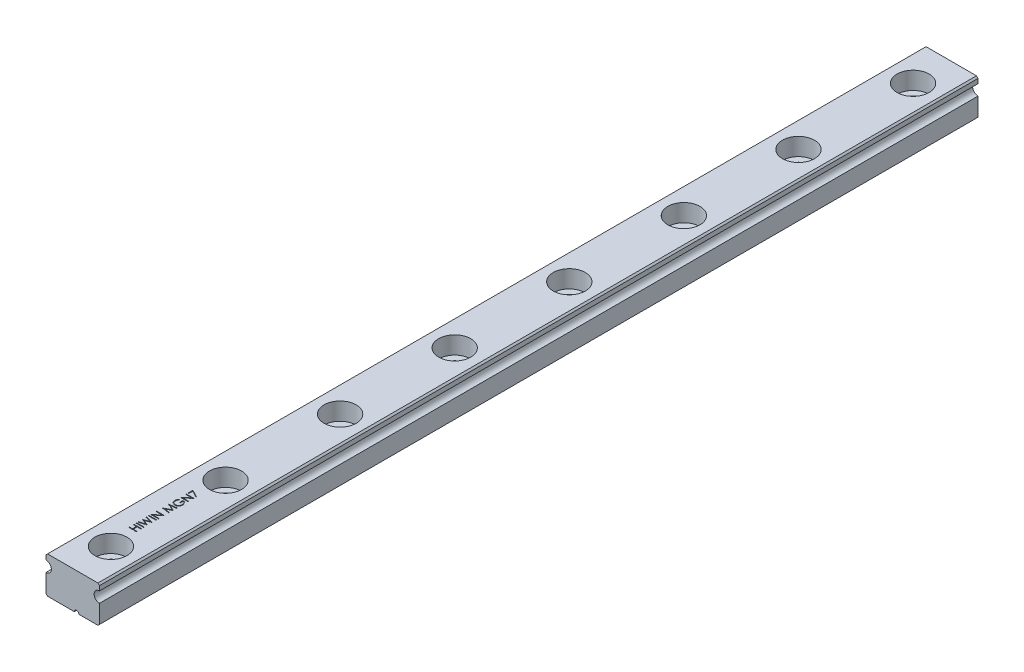
from build123d import *

# Parameters (mm, degrees)
EXTRUDE_1_DEPTH              = 115
HOLE_WIZARD_M2_1_D           = 2.4
HOLE_WIZARD_M2_1_CBORE_D     = 4.2
HOLE_WIZARD_M2_1_CBORE_DEPTH = 2.3
PATTERN_LINEAR_1_COUNT       = 8
PATTERN_LINEAR_1_PITCH       = 15
SKETCH_6_W                   = 1
SKETCH_6_H                   = 0.089743589
CUT_EXTRUDE_1_DEPTH          = 0.1


with BuildPart() as part:
    # 草图1 → 凸台-拉伸1 (new body)
    with BuildSketch(Plane.XY):
        with BuildLine():
            Line((-3.5, 4.6), (-3.5, 4))
            ThreePointArc((-3.5, 4), (-2.8, 3.3), (-3.5, 2.6))
            Line((-3.5, 2.6), (-3.5, 0.2))
            Line((-3.5, 0.2), (-3.3, 0))
            Line((-3.3, 0), (0.2, 0))
            ThreePointArc((0.2, 0), (0.5, 0.3), (0.8, 0))
            Line((0.8, 0), (3.3, 0))
            Line((3.3, 0), (3.5, 0.2))
            Line((3.5, 0.2), (3.5, 2.6))
            ThreePointArc((3.5, 2.6), (2.8, 3.3), (3.5, 4))
            Line((3.5, 4), (3.5, 4.6))
            Line((3.5, 4.6), (3.3, 4.8))
            Line((3.3, 4.8), (-3.3, 4.8))
            Line((-3.3, 4.8), (-3.5, 4.6))
        make_face()
    extrude(amount=-EXTRUDE_1_DEPTH)

    # M2 六角凹头螺钉的柱形沉头孔1 (through all)
    with Locations(Plane(origin=(1.647961524, 4.8, 19.977127426), x_dir=(-1, 0, 0), z_dir=(0, 1, 0))):
        with Locations((1.647961524, -24.977127426)):
            hole_wizard_m2_1 = CounterBoreHole(HOLE_WIZARD_M2_1_D / 2, HOLE_WIZARD_M2_1_CBORE_D / 2, HOLE_WIZARD_M2_1_CBORE_DEPTH)

    # 阵列(线性)1: M2 六角凹头螺钉的柱形沉头孔1 ×8
    with Locations(*[(0, 0, -i * PATTERN_LINEAR_1_PITCH) for i in range(1, PATTERN_LINEAR_1_COUNT)]):
        add(hole_wizard_m2_1, mode=Mode.SUBTRACT)

    # 草图6 → 切除-拉伸1 (cut)
    with BuildSketch(Plane(origin=(0, 4.8, 0), x_dir=(1, 0, 0), z_dir=(0, 1, 0))):
        Polygon((-1, 8.326923077), (-1, 8.416666667), (-0.58974359, 8.416666667), (-0.58974359, 8.929487179), (-1, 8.929487179), (-1, 9.019230769), (0, 9.019230769), (0, 8.929487179), (-0.487179487, 8.929487179), (-0.487179487, 8.416666667), (0, 8.416666667), (0, 8.326923077), align=None)
        with Locations((-0.5, 9.32051282)):
            Rectangle(SKETCH_6_W, SKETCH_6_H)
        Polygon((-1, 9.519230769), (-1, 9.611979167), (-0.266626603, 9.807692308), (-1, 10.098758013), (-1, 10.111778846), (-0.271634615, 10.397435897), (-1, 10.594150641), (-1, 10.685897436), (0, 10.416266026), (0, 10.403445513), (-0.764823718, 10.102564103), (0, 9.798076923), (0, 9.78525641), align=None)
        with Locations((-0.5, 10.961538462)):
            Rectangle(SKETCH_6_W, SKETCH_6_H)
        Polygon((0, 11.224358974), (-1, 11.224358974), (-1, 11.243189103), (-0.212940705, 11.903846154), (-1, 11.903846154), (-1, 11.993589744), (0, 11.993589744), (0, 11.973157051), (-0.78525641, 11.314102564), (0, 11.314102564), align=None)
        Polygon((0, 12.583333333), (-1, 12.715344551), (-1, 12.728165064), (-0.179487179, 13.141025641), (-1, 13.552884615), (-1, 13.565905449), (0, 13.698717949), (0, 13.608573718), (-0.719551282, 13.512820513), (0, 13.151842949), (0, 13.131610577), (-0.721153846, 12.769230769), (0, 12.673677885), align=None)
        with BuildLine():
            Line((-0.829326923, 14.83974359), (-0.756410256, 14.762820513))
            add(Edge.make_bspline(
                [(-0.756410256, 14.762820513), (-0.769509177, 14.748903633), (-0.795394667, 14.721401728), (-0.828926878, 14.676487459), (-0.857936286, 14.629814358), (-0.881363598, 14.581306958), (-0.899741215, 14.532237244), (-0.913100062, 14.483448972), (-0.921560108, 14.435258029), (-0.922576227, 14.403211086), (-0.923076923, 14.387419872)],
                knots=[0, 0, 0, 0, 1.089067066, 2.152164705, 3.18986567, 4.218445106, 5.218487318, 6.173592265, 7.100032889, 8, 8, 8, 8], degree=3))
            add(Edge.make_bspline(
                [(-0.923076923, 14.387419872), (-0.92295875, 14.377729958), (-0.92272271, 14.35837526), (-0.919710077, 14.329626133), (-0.915377259, 14.301178523), (-0.909108151, 14.27308613), (-0.901162706, 14.245294334), (-0.891224001, 14.217899794), (-0.879636792, 14.190851402), (-0.8662475, 14.164403968), (-0.851539021, 14.138763759), (-0.835239261, 14.11454776), (-0.817871683, 14.091600199), (-0.798997604, 14.070357569), (-0.778802089, 14.050678565), (-0.757648841, 14.032201222), (-0.735121964, 14.015269914), (-0.711314092, 14.000188302), (-0.686779105, 13.98656899), (-0.661725084, 13.97479979), (-0.636384612, 13.964568374), (-0.61056688, 13.956775814), (-0.584538056, 13.950175564), (-0.558161739, 13.945580925), (-0.531369048, 13.942981978), (-0.513426849, 13.942533266), (-0.504407051, 13.942307692)],
                knots=[0, 0, 0, 0, 1.028150113, 2.053633673, 3.06513288, 4.081487945, 5.106702018, 6.131327874, 7.172780699, 8.228344599, 9.276313556, 10.308389736, 11.324843658, 12.329040066, 13.321460474, 14.316307835, 15.308626991, 16.309440696, 17.305625405, 18.28535951, 19.246194545, 20.203493668, 21.145557131, 22.095268976, 23.042464743, 24, 24, 24, 24], degree=3))
            add(Edge.make_bspline(
                [(-0.504407051, 13.942307692), (-0.495186862, 13.942523748), (-0.476771662, 13.94295527), (-0.449286976, 13.945713326), (-0.422213666, 13.950843386), (-0.395509151, 13.957646743), (-0.369120284, 13.966296079), (-0.343074603, 13.976922511), (-0.31737464, 13.989581406), (-0.292275521, 14.004201769), (-0.267846912, 14.020347331), (-0.244643347, 14.038104812), (-0.222934856, 14.057504108), (-0.202404358, 14.078189521), (-0.183181421, 14.10034952), (-0.165497749, 14.1241991), (-0.149079898, 14.149404412), (-0.134108231, 14.175976638), (-0.120734697, 14.203634918), (-0.108842066, 14.231993898), (-0.099047993, 14.261144727), (-0.091065671, 14.29093406), (-0.084522731, 14.321326426), (-0.08031345, 14.352476083), (-0.077258927, 14.384154), (-0.077035593, 14.405507895), (-0.076923077, 14.416266026)],
                knots=[0, 0, 0, 0, 0.935915162, 1.869274651, 2.799799983, 3.730201895, 4.664668062, 5.616159355, 6.583070886, 7.570012957, 8.562524459, 9.553461134, 10.53281078, 11.515274572, 12.509912756, 13.507571325, 14.526460018, 15.561318395, 16.601025881, 17.643204557, 18.680545676, 19.719612342, 20.772381578, 21.833430283, 22.908478249, 24, 24, 24, 24], degree=3))
            add(Edge.make_bspline(
                [(-0.076923077, 14.416266026), (-0.077193986, 14.429231321), (-0.077725961, 14.454690783), (-0.081870496, 14.492114732), (-0.088335201, 14.528061194), (-0.097832073, 14.562413148), (-0.109852773, 14.595295261), (-0.124718081, 14.626586257), (-0.142271591, 14.656372541), (-0.162157847, 14.684525187), (-0.184314551, 14.710374908), (-0.208010182, 14.733901216), (-0.233551734, 14.754295108), (-0.260558548, 14.77216577), (-0.28928895, 14.786936411), (-0.319583111, 14.799063805), (-0.351459775, 14.808358792), (-0.373485924, 14.812174532), (-0.384615385, 14.814102564)],
                knots=[0, 0, 0, 0, 1.130199668, 2.219330667, 3.279027493, 4.311506524, 5.322739849, 6.327972234, 7.327472899, 8.33386792, 9.329086447, 10.29244429, 11.240784345, 12.174119183, 13.111530729, 14.052100829, 15.015757696, 16, 16, 16, 16], degree=3))
            Line((-0.384615385, 14.814102564), (-0.384615385, 14.480769231))
            Line((-0.384615385, 14.480769231), (-0.487179487, 14.480769231))
            Line((-0.487179487, 14.480769231), (-0.487179487, 14.903846154))
            add(Edge.make_bspline(
                [(-0.487179487, 14.903846154), (-0.468063062, 14.903358769), (-0.430648764, 14.902404868), (-0.37608583, 14.895713749), (-0.32455106, 14.884909031), (-0.275990182, 14.870148942), (-0.230472013, 14.851041719), (-0.187950337, 14.827792425), (-0.148699857, 14.800028962), (-0.112400142, 14.768740264), (-0.080020367, 14.733625991), (-0.051561527, 14.695634957), (-0.027589351, 14.654704394), (-0.008086305, 14.610873021), (0.007134836, 14.564284325), (0.017926715, 14.514830502), (0.024392419, 14.462578617), (0.025218528, 14.426768137), (0.025641026, 14.408453526)],
                knots=[0, 0, 0, 0, 1.140356446, 2.231883559, 3.274166699, 4.278491846, 5.25512956, 6.21435461, 7.1637429, 8.11826594, 9.068280886, 10.0076534, 10.945064095, 11.891975133, 12.864533718, 13.863980011, 14.907571808, 16, 16, 16, 16], degree=3))
            add(Edge.make_bspline(
                [(0.025641026, 14.408453526), (0.02547842, 14.397164916), (0.025157708, 14.374900138), (0.022878466, 14.342017016), (0.01936973, 14.310040553), (0.014071123, 14.278975407), (0.007581222, 14.24870731), (-0.000729269, 14.219387428), (-0.010348898, 14.190904073), (-0.021290519, 14.16321322), (-0.033968135, 14.136566207), (-0.048056603, 14.110844345), (-0.063483278, 14.085905452), (-0.080514948, 14.061919405), (-0.099024222, 14.038761227), (-0.119048199, 14.016580243), (-0.140525662, 13.995252278), (-0.155776807, 13.981892146), (-0.163461538, 13.975160256)],
                knots=[0, 0, 0, 0, 1.107784379, 2.184907829, 3.233506516, 4.263428166, 5.276301166, 6.270063455, 7.25232949, 8.225834625, 9.190232166, 10.146266622, 11.1027726, 12.066435141, 13.031522626, 14.010570082, 14.99756817, 16, 16, 16, 16], degree=3))
            add(Edge.make_bspline(
                [(-0.163461538, 13.975160256), (-0.175653154, 13.965392847), (-0.199834016, 13.946020158), (-0.238576857, 13.921083542), (-0.278691674, 13.899825998), (-0.320290139, 13.882578049), (-0.363333343, 13.869110024), (-0.407766283, 13.859451095), (-0.453646178, 13.853791869), (-0.484693396, 13.852976573), (-0.500400641, 13.852564103)],
                knots=[0, 0, 0, 0, 1.023165419, 2.029347347, 3.013907458, 3.994755782, 4.975994455, 5.96558838, 6.970761222, 8, 8, 8, 8], degree=3))
            add(Edge.make_bspline(
                [(-0.500400641, 13.852564103), (-0.512162428, 13.852716171), (-0.535536515, 13.853018374), (-0.570238603, 13.856682808), (-0.604324516, 13.861940354), (-0.637766384, 13.86966809), (-0.670586575, 13.879409857), (-0.702800197, 13.89156808), (-0.734426755, 13.905723445), (-0.765246694, 13.92217765), (-0.794858013, 13.940483004), (-0.823115804, 13.960370906), (-0.849562095, 13.981994816), (-0.874258149, 14.0054177), (-0.897569993, 14.030167394), (-0.919010679, 14.05676348), (-0.938915717, 14.084803005), (-0.956902635, 14.11450333), (-0.973064879, 14.145395796), (-0.987232901, 14.177413249), (-0.998942507, 14.210544055), (-1.008877849, 14.244540499), (-1.016225039, 14.279659779), (-1.02155325, 14.315647077), (-1.025199136, 14.352689966), (-1.025492352, 14.377728831), (-1.025641026, 14.390424679)],
                knots=[0, 0, 0, 0, 1.00895651, 2.005089799, 2.991467152, 3.967318338, 4.948153826, 5.927364234, 6.919980553, 7.91976625, 8.923240147, 9.905815003, 10.88314567, 11.851989312, 12.825009789, 13.798721852, 14.781296708, 15.773896486, 16.776076962, 17.771600213, 18.775744723, 19.78957137, 20.808953803, 21.851964491, 22.910847925, 24, 24, 24, 24], degree=3))
            add(Edge.make_bspline(
                [(-1.025641026, 14.390424679), (-1.025475457, 14.400778463), (-1.025147153, 14.4213088), (-1.022871539, 14.451859009), (-1.019264716, 14.481937014), (-1.014342777, 14.511587411), (-1.007638865, 14.54070923), (-0.999616498, 14.569385431), (-0.990275977, 14.597657584), (-0.979136307, 14.625437084), (-0.966492414, 14.652910717), (-0.952260008, 14.680231243), (-0.936195721, 14.707305313), (-0.918251853, 14.73417988), (-0.898736591, 14.76102441), (-0.877091784, 14.787414308), (-0.854170997, 14.813986578), (-0.837690373, 14.831072811), (-0.829326923, 14.83974359)],
                knots=[0, 0, 0, 0, 0.985871117, 1.954866573, 2.915460327, 3.869826059, 4.81536089, 5.759505086, 6.70452669, 7.649098992, 8.607881297, 9.583363685, 10.581137262, 11.603961102, 12.659522466, 13.73993555, 14.853081303, 16, 16, 16, 16], degree=3))
        make_face()
        Polygon((0, 15.108974359), (-1, 15.108974359), (-1, 15.127804487), (-0.212940705, 15.788461538), (-1, 15.788461538), (-1, 15.878205128), (0, 15.878205128), (0, 15.857772436), (-0.78525641, 15.198717949), (0, 15.198717949), align=None)
        Polygon((-1, 16.108974359), (-1, 16.724358974), (0.025641026, 16.198717949), (-0.017027244, 16.12119391), (-0.897435897, 16.572516026), (-0.897435897, 16.108974359), align=None)
    extrude(amount=-CUT_EXTRUDE_1_DEPTH, mode=Mode.SUBTRACT)


solid = part.part
